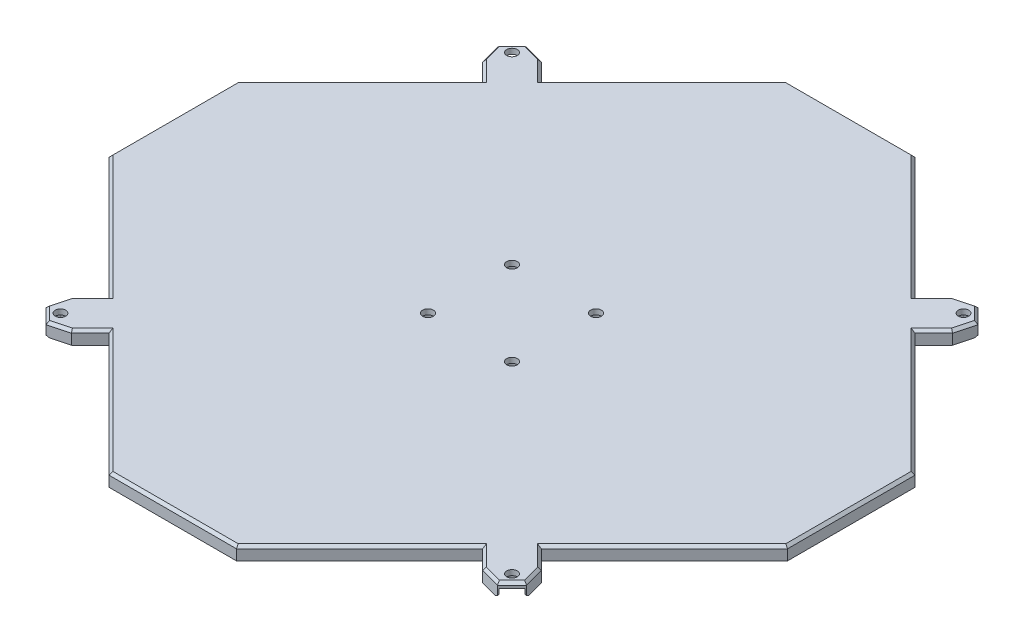
from build123d import *

# Parameters (mm, degrees)
SKETCH2_R                                  = 2
SKETCH2_R_2                                = 1.999999996
MAIN_FLOOR_EXTRUDE_DEPTH                   = 5
MAIN_FLOOR_CHAMFER_SIZE                    = 1
MOUNT_SCREW_COUNTERSINK_DEPTH              = 3
MOUNT_SCREW_COUNTERSINK_CHAMFER_SIZE       = 1
SKETCH6_R                                  = 2.05
BOTTOM_MOTOR_MOUNT_HOLES_DEPTH             = 183.816359737
SKETCH7_R                                  = 3.5
BOTTOM_MOTOR_MOUNT_HOLES_COUNTERSINK_DEPTH = 3


with BuildPart() as part:
    # Sketch2 → Main Floor Extrude (new body)
    with BuildSketch(Plane(origin=(0, 0, 0), x_dir=(1, 0, 0), z_dir=(0, 1, 0))):
        Polygon((129.222330464, 0), (129.222330464, -24.28090912), (82.337763357, -71.165476227), (89.511362957, -78.339075827), (91.560037368, -85.984832777), (85.984832777, -91.560037368), (78.339075822, -89.511362977), (71.165476214, -82.33776337), (24.280909108, -129.222330477), (0, -129.222330477), (-24.28090912, -129.222330477), (-71.165476227, -82.33776337), (-78.339075827, -89.51136297), (-85.984832777, -91.560037381), (-91.560037368, -85.984832789), (-89.511362977, -78.339075834), (-82.33776337, -71.165476227), (-129.222330477, -24.28090912), (-129.222330477, -1.3e-08), (-129.222330477, 24.280909108), (-82.33776337, 71.165476214), (-89.51136297, 78.339075814), (-91.560037381, 85.984832764), (-85.984832789, 91.560037355), (-78.339075834, 89.511362964), (-71.165476227, 82.337763357), (-24.28090912, 129.222330464), (-1.3e-08, 129.222330464), (24.280909108, 129.222330464), (71.165476214, 82.337763357), (78.339075814, 89.511362957), (85.984832764, 91.560037368), (91.560037355, 85.984832777), (89.511362964, 78.339075822), (82.337763357, 71.165476214), (129.222330464, 24.280909108), align=None)
        with Locations(Location((86.014718626, -86.014718626, 0), (0, 0, 270))):
            Circle(SKETCH2_R, mode=Mode.SUBTRACT)
        with Locations(Location((-86.014718626, -86.014718639, 0), (0, 0, 270))):
            Circle(SKETCH2_R, mode=Mode.SUBTRACT)
        with Locations(Location((-86.014718639, 86.014718613, 0), (0, 0, 270))):
            Circle(SKETCH2_R, mode=Mode.SUBTRACT)
        with Locations(Location((86.014718613, 86.014718626, 0), (0, 0, 270))):
            Circle(SKETCH2_R_2, mode=Mode.SUBTRACT)
    extrude(amount=MAIN_FLOOR_EXTRUDE_DEPTH)

    # Main Floor Chamfer
    main_floor_chamfer_edges = [part.edges().sort_by_distance(p)[0] for p in [
        (-74.752276027, 5, 85.92456317),
        (-47.723192674, 5, 105.780046923),
        (-6e-09, 5, 129.222330477),
        (47.723192661, 5, 105.780046923),
        (74.752276018, 5, 85.924563174),
        (82.161954299, 5, 90.535700173),
        (88.772435072, 5, 88.772435072),
        (85.924563161, 5, -74.752276018),
        (90.535700163, 5, 82.161954302),
        (85.924563157, 5, 74.752276027),
        (105.780046911, 5, 47.723192674),
        (90.53570016, 5, -82.161954299),
        (88.77243506, 5, -88.772435072),
        (82.161954289, 5, -90.535700163),
        (74.752276014, 5, -85.924563157),
        (47.723192661, 5, -105.780046911),
        (-6e-09, 5, -129.222330464),
        (-47.723192674, 5, -105.780046911),
        (-74.752276031, 5, -85.924563161),
        (129.222330464, 5, 6e-09),
        (-82.161954312, 5, -90.53570016),
        (-88.772435085, 5, -88.77243506),
        (-90.535700175, 5, -82.161954289),
        (-85.92456317, 5, -74.752276014),
        (-105.780046923, 5, -47.723192661),
        (-129.222330477, 5, 6e-09),
        (-105.780046923, 5, 47.723192674),
        (-85.924563174, 5, 74.752276031),
        (-90.535700173, 5, 82.161954312),
        (105.780046911, 5, -47.723192661),
        (-88.772435072, 5, 88.772435085),
        (-82.161954302, 5, 90.535700175),
    ]]
    chamfer(main_floor_chamfer_edges, length=MAIN_FLOOR_CHAMFER_SIZE)

    # Sketch3 → Mount Screw Countersink (cut)
    with BuildSketch(Plane(origin=(0, 0, 0), x_dir=(-1, 0, 0), z_dir=(0, -1, 0))):
        with BuildLine():
            Line((91.247308807, -86.297561351), (88.48959236, -83.539844904))
            ThreePointArc((88.48959236, -83.539844904), (83.539844892, -83.539844904), (83.539844892, -88.489592373))
            Line((83.539844892, -88.489592373), (86.297561338, -91.247308819))
            Line((86.297561338, -91.247308819), (91.247308807, -86.297561351))
        make_face()
        with BuildLine():
            Line((-86.297561351, -91.247308807), (-83.539844904, -88.48959236))
            ThreePointArc((-83.539844904, -88.48959236), (-83.539844904, -83.539844892), (-88.489592373, -83.539844892))
            Line((-88.489592373, -83.539844892), (-91.247308819, -86.297561338))
            Line((-91.247308819, -86.297561338), (-86.297561351, -91.247308807))
        make_face()
        with BuildLine():
            Line((-91.247308807, 86.297561351), (-88.48959236, 83.539844904))
            ThreePointArc((-88.48959236, 83.539844904), (-83.539844892, 83.539844904), (-83.539844892, 88.489592373))
            Line((-83.539844892, 88.489592373), (-86.297561338, 91.247308819))
            Line((-86.297561338, 91.247308819), (-91.247308807, 86.297561351))
        make_face()
        with BuildLine():
            Line((86.297561351, 91.247308807), (83.539844904, 88.48959236))
            ThreePointArc((83.539844904, 88.48959236), (83.539844904, 83.539844892), (88.489592373, 83.539844892))
            Line((88.489592373, 83.539844892), (91.247308819, 86.297561338))
            Line((91.247308819, 86.297561338), (86.297561351, 91.247308807))
        make_face()
    extrude(amount=-MOUNT_SCREW_COUNTERSINK_DEPTH, mode=Mode.SUBTRACT)

    # Mount Screw Countersink Chamfer
    mount_screw_countersink_chamfer_edges = [part.edges().sort_by_distance(p)[0] for p in [
        (-84.918703128, 0, -89.868450583),
        (-89.868450596, 0, -84.918703115),
        (-83.539844904, 0, -83.539844892),
        (89.868450583, 0, -84.918703128),
        (84.918703115, 0, -89.868450596),
        (83.539844892, 0, -83.539844904),
        (84.918703128, 0, 89.868450583),
        (89.868450596, 0, 84.918703115),
        (83.539844904, 0, 83.539844892),
        (-89.868450583, 0, 84.918703128),
        (-84.918703115, 0, 89.868450596),
        (-83.539844892, 0, 83.539844904),
    ]]
    chamfer(mount_screw_countersink_chamfer_edges, length=MOUNT_SCREW_COUNTERSINK_CHAMFER_SIZE)

    # Sketch6 → Bottom Motor Mount Holes (cut, through all)
    with BuildSketch(Plane(origin=(0, 5, 0), x_dir=(1, 0, 0), z_dir=(0, 1, 0))):
        with Locations(Location((-16, 16, 0), (0, 0, 270))):
            Circle(SKETCH6_R)
        with Locations(Location((16, 16, 0), (0, 0, 270))):
            Circle(SKETCH6_R)
        with Locations(Location((16, -16, 0), (0, 0, 270))):
            Circle(SKETCH6_R)
        with Locations(Location((-16, -16, 0), (0, 0, 270))):
            Circle(SKETCH6_R)
    extrude(amount=-BOTTOM_MOTOR_MOUNT_HOLES_DEPTH, mode=Mode.SUBTRACT)

    # Sketch7 → Bottom Motor Mount Holes Countersink (cut)
    with BuildSketch(Plane(origin=(0, 0, 0), x_dir=(-1, 0, 0), z_dir=(0, -1, 0))):
        with Locations(Location((16, -16, 0), (0, 0, 90))):
            Circle(SKETCH7_R)
        with Locations(Location((-16, -16, 0), (0, 0, 90))):
            Circle(SKETCH7_R)
        with Locations(Location((-16, 16, 0), (0, 0, 90))):
            Circle(SKETCH7_R)
        with Locations(Location((16, 16, 0), (0, 0, 90))):
            Circle(SKETCH7_R)
    extrude(amount=-BOTTOM_MOTOR_MOUNT_HOLES_COUNTERSINK_DEPTH, mode=Mode.SUBTRACT)


solid = part.part
